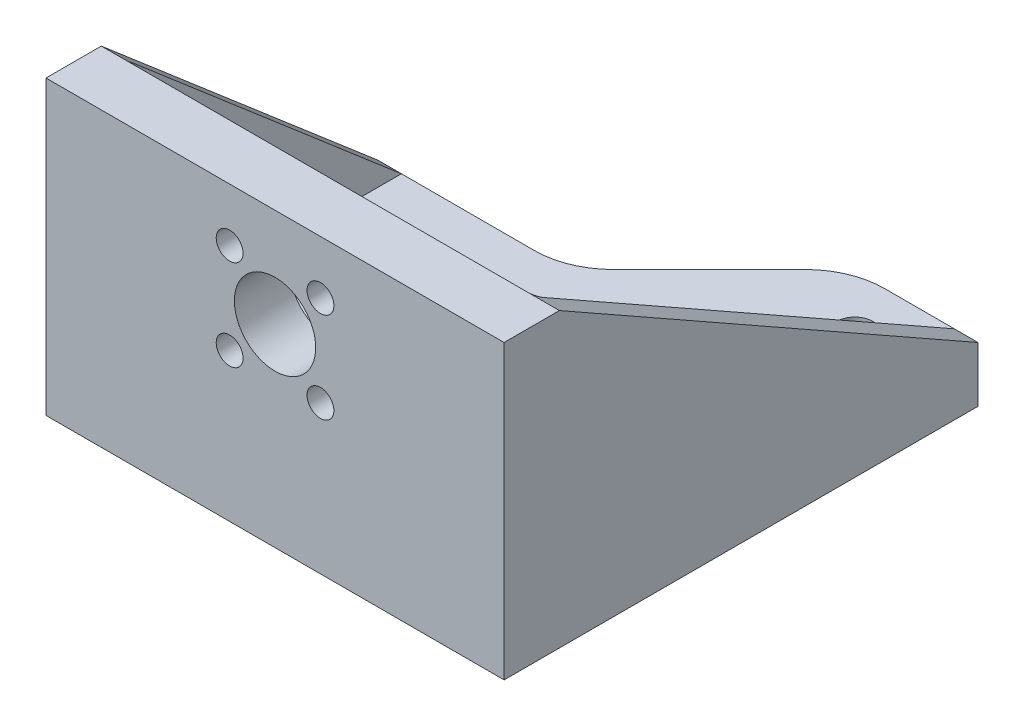
from build123d import *

# Parameters (mm, degrees)
SKETCH1_W            = 58
SKETCH1_H            = 60
BOSS_EXTRUDE1_DEPTH  = 7
SKETCH2_W            = 58
SKETCH2_H            = 7
BOSS_EXTRUDE2_DEPTH  = 30
SKETCH5_R            = 5.15
CUT_EXTRUDE1_DEPTH   = 87.844688957
M3_CLEARANCE_HOLE1_D = 3.4
SUPPORT_DEPTH        = 3
M4_CLEARANCE_HOLE2_D = 4.5
CUT_EXTRUDE5_DEPTH   = 89.67919711
BOSS_EXTRUDE6_DEPTH  = 3
FILLET2_R            = 10
FILLET3_R            = 1


with BuildPart() as part:
    # Sketch1 → Boss-Extrude1 (new body)
    with BuildSketch(Plane(origin=(0, 0, 0), x_dir=(1, 0, 0), z_dir=(0, 1, 0))):
        with Locations((29, 30)):
            Rectangle(SKETCH1_W, SKETCH1_H)
    extrude(amount=BOSS_EXTRUDE1_DEPTH)

    # Sketch2 → Boss-Extrude2 (add)
    with BuildSketch(Plane(origin=(0, 7, 0), x_dir=(1, 0, 0), z_dir=(0, 1, 0))):
        with Locations((29, 3.5)):
            Rectangle(SKETCH2_W, SKETCH2_H)
    extrude(amount=BOSS_EXTRUDE2_DEPTH)

    # Sketch5 → Cut-Extrude1 (cut, through all)
    with BuildSketch(Plane(origin=(0, 0, -7), x_dir=(-1, 0, 0), z_dir=(0, 0, -1))):
        with Locations((-29, 24.5)):
            Circle(SKETCH5_R)
    extrude(amount=-CUT_EXTRUDE1_DEPTH, mode=Mode.SUBTRACT)

    # M3 Clearance Hole1 (through all)
    with Locations(Plane(origin=(0, 0, -7), x_dir=(-1, 0, 0), z_dir=(0, 0, -1))):
        with Locations((-34.75, 18.75), (-23.25, 18.75), (-23.25, 30.25), (-34.75, 30.25)):
            Hole(M3_CLEARANCE_HOLE1_D / 2)

    # Sketch15 → support (add)
    with BuildSketch(Plane(origin=(58, 0, 0), x_dir=(0, 0, -1), z_dir=(1, 0, 0))):
        Polygon((60, 7), (7, 37), (7, 7), align=None)
    extrude(amount=-SUPPORT_DEPTH)

    # M4 Clearance Hole2 (through all)
    with Locations(Plane(origin=(0, 7, 0), x_dir=(1, 0, 0), z_dir=(0, 1, 0))):
        with Locations((49, 53.4), (49, 13.4), (9, 33.4)):
            Hole(M4_CLEARANCE_HOLE2_D / 2)

    # Sketch21 → Cut-Extrude5 (cut, through all)
    with BuildSketch(Plane(origin=(0, 7, 0), x_dir=(1, 0, 0), z_dir=(0, 1, 0))):
        Polygon((42, 60), (24, 42), (0, 42), (0, 60), align=None)
    extrude(amount=-CUT_EXTRUDE5_DEPTH, mode=Mode.SUBTRACT)

    # Sketch22 → Boss-Extrude6 (add)
    with BuildSketch(Plane.ZY):
        Polygon((-42, 7), (-7, 37), (-7, 7), align=None)
    extrude(amount=-BOSS_EXTRUDE6_DEPTH)

    # Fillet2
    fillet2_edges = [part.edges().sort_by_distance(p)[0] for p in [
        (42, 3.5, -60),
        (24, 3.5, -42),
    ]]
    fillet(fillet2_edges, radius=FILLET2_R)

    # Fillet3
    fillet3_edges = [part.edges().sort_by_distance(p)[0] for p in [
        (29, 7, -7),
        (55, 22, -7),
        (3, 22, -7),
    ]]
    fillet(fillet3_edges, radius=FILLET3_R)


solid = part.part
